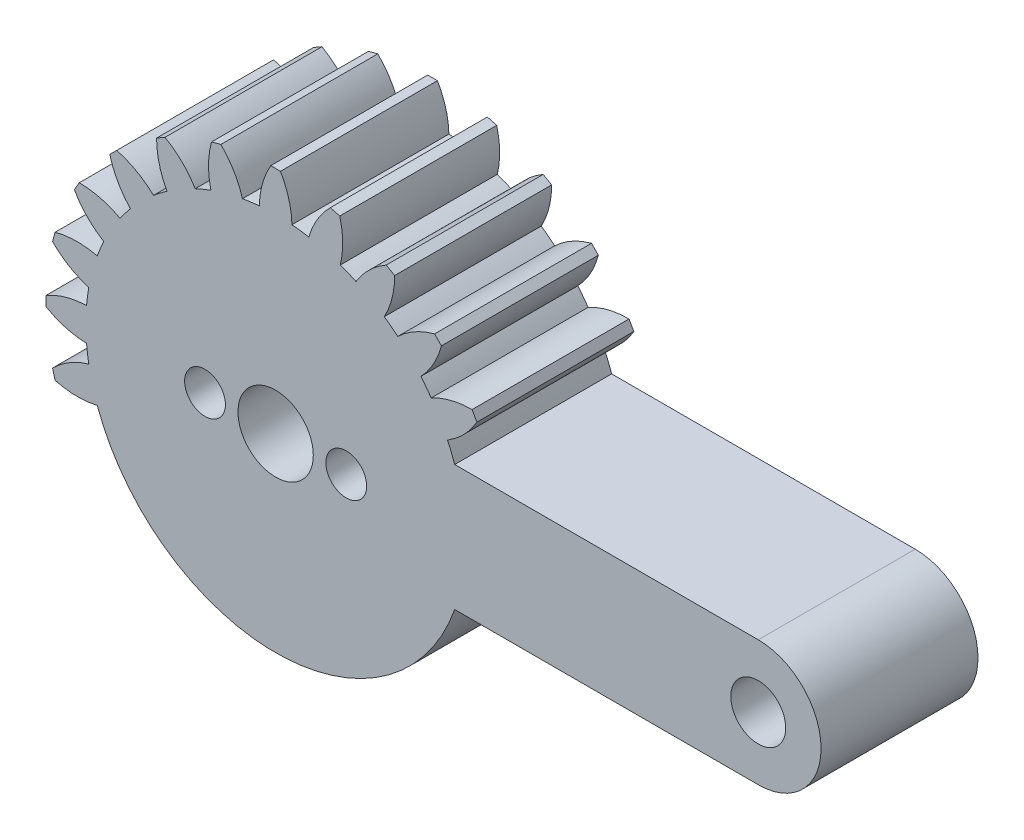
from build123d import *

# Parameters (mm, degrees)
SKETCH2_R           = 1.75
BOSS_EXTRUDE1_DEPTH = 10
SKETCH3_R           = 1.3
SKETCH3_R_2         = 2.4
CUT_EXTRUDE1_DEPTH  = 40.007683858


with BuildPart() as part:
    # Sketch2 → Boss-Extrude1 (new body)
    with BuildSketch(Plane.XY):
        with BuildLine():
            Line((0.31, 14.63), (-0.31, 14.63))
            ThreePointArc((-0.31, 14.63), (-0.838273314, 13.383704325), (-1.04, 12.04518576))
            ThreePointArc((-1.04, 12.04518576), (-1.578061664, 11.986568374), (-2.112960617, 11.903927815))
            ThreePointArc((-2.112960617, 11.903927815), (-2.65424773, 13.144626757), (-3.487085624, 14.211728743))
            Line((-3.487085624, 14.211728743), (-4.085959636, 14.051260935))
            ThreePointArc((-4.085959636, 14.051260935), (-4.273667417, 12.71070456), (-4.122086336, 11.365584201))
            ThreePointArc((-4.122086336, 11.365584201), (-4.626642697, 11.169703548), (-5.12192646, 10.951436862))
            ThreePointArc((-5.12192646, 10.951436862), (-5.965886177, 12.009764599), (-7.046532125, 12.824951657))
            Line((-7.046532125, 12.824951657), (-7.583467875, 12.514951657))
            ThreePointArc((-7.583467875, 12.514951657), (-7.417818147, 11.171491285), (-6.9232593, 9.911436862))
            ThreePointArc((-6.9232593, 9.911436862), (-7.359925677, 9.591641884), (-7.781841479, 9.252623584))
            ThreePointArc((-7.781841479, 9.252623584), (-8.870959341, 10.05645683), (-10.125769107, 10.564175311))
            Line((-10.125769107, 10.564175311), (-10.564175311, 10.125769107))
            ThreePointArc((-10.564175311, 10.125769107), (-10.05645683, 8.870959341), (-9.252623584, 7.781841479))
            ThreePointArc((-9.252623584, 7.781841479), (-9.591641884, 7.359925677), (-9.911436862, 6.9232593))
            ThreePointArc((-9.911436862, 6.9232593), (-11.171491285, 7.417818147), (-12.514951657, 7.583467875))
            Line((-12.514951657, 7.583467875), (-12.824951657, 7.046532125))
            ThreePointArc((-12.824951657, 7.046532125), (-12.009764599, 5.965886177), (-10.951436862, 5.12192646))
            ThreePointArc((-10.951436862, 5.12192646), (-11.169703548, 4.626642697), (-11.365584201, 4.122086336))
            ThreePointArc((-11.365584201, 4.122086336), (-12.71070456, 4.273667417), (-14.051260935, 4.085959636))
            Line((-14.051260935, 4.085959636), (-14.211728743, 3.487085624))
            ThreePointArc((-14.211728743, 3.487085624), (-13.144626757, 2.65424773), (-11.903927815, 2.112960617))
            ThreePointArc((-11.903927815, 2.112960617), (-11.986568374, 1.578061664), (-12.04518576, 1.04))
            ThreePointArc((-12.04518576, 1.04), (-13.383704325, 0.838273314), (-14.63, 0.31))
            Line((-14.63, 0.31), (-14.63, -0.31))
            ThreePointArc((-14.63, -0.31), (-13.383704325, -0.838273314), (-12.04518576, -1.04))
            ThreePointArc((-12.04518576, -1.04), (-11.986568374, -1.578061664), (-11.903927815, -2.112960617))
            ThreePointArc((-11.903927815, -2.112960617), (-13.144626757, -2.65424773), (-14.211728743, -3.487085624))
            Line((-14.211728743, -3.487085624), (-14.051260935, -4.085959636))
            ThreePointArc((-14.051260935, -4.085959636), (-12.71070456, -4.273667417), (-11.365584201, -4.122086336))
            ThreePointArc((-11.365584201, -4.122086336), (0.064808849, -12.089826294), (11.409123542, -4))
            Line((11.409123542, -4), (30.75, -4))
            ThreePointArc((30.75, -4), (34.75, 0), (30.75, 4))
            Line((30.75, 4), (11.409123542, 4))
            ThreePointArc((11.409123542, 4), (11.194344337, 4.566700654), (10.951436862, 5.12192646))
            ThreePointArc((10.951436862, 5.12192646), (12.009764599, 5.965886177), (12.824951657, 7.046532125))
            Line((12.824951657, 7.046532125), (12.514951657, 7.583467875))
            ThreePointArc((12.514951657, 7.583467875), (11.171491285, 7.417818147), (9.911436862, 6.9232593))
            ThreePointArc((9.911436862, 6.9232593), (9.591641884, 7.359925677), (9.252623584, 7.781841479))
            ThreePointArc((9.252623584, 7.781841479), (10.05645683, 8.870959341), (10.564175311, 10.125769107))
            Line((10.564175311, 10.125769107), (10.125769107, 10.564175311))
            ThreePointArc((10.125769107, 10.564175311), (8.870959341, 10.05645683), (7.781841479, 9.252623584))
            ThreePointArc((7.781841479, 9.252623584), (7.359925677, 9.591641884), (6.9232593, 9.911436862))
            ThreePointArc((6.9232593, 9.911436862), (7.417818147, 11.171491285), (7.583467875, 12.514951657))
            Line((7.583467875, 12.514951657), (7.046532125, 12.824951657))
            ThreePointArc((7.046532125, 12.824951657), (5.965886177, 12.009764599), (5.12192646, 10.951436862))
            ThreePointArc((5.12192646, 10.951436862), (4.626642697, 11.169703548), (4.122086336, 11.365584201))
            ThreePointArc((4.122086336, 11.365584201), (4.273667417, 12.71070456), (4.085959636, 14.051260935))
            Line((4.085959636, 14.051260935), (3.487085624, 14.211728743))
            ThreePointArc((3.487085624, 14.211728743), (2.65424773, 13.144626757), (2.112960617, 11.903927815))
            ThreePointArc((2.112960617, 11.903927815), (1.578061664, 11.986568374), (1.04, 12.04518576))
            ThreePointArc((1.04, 12.04518576), (0.838273314, 13.383704325), (0.31, 14.63))
        make_face()
        Circle(SKETCH2_R, mode=Mode.SUBTRACT)
        with Locations((30.75, 0)):
            Circle(SKETCH2_R, mode=Mode.SUBTRACT)
    extrude(amount=BOSS_EXTRUDE1_DEPTH)

    # Sketch3 → Cut-Extrude1 (cut, through all)
    with BuildSketch(Plane.XY.offset(10)):
        with Locations((-4.5, 0)):
            Circle(SKETCH3_R)
        with Locations((4.5, 0)):
            Circle(SKETCH3_R)
        Circle(SKETCH3_R_2)
    extrude(amount=-CUT_EXTRUDE1_DEPTH, mode=Mode.SUBTRACT)


solid = part.part
